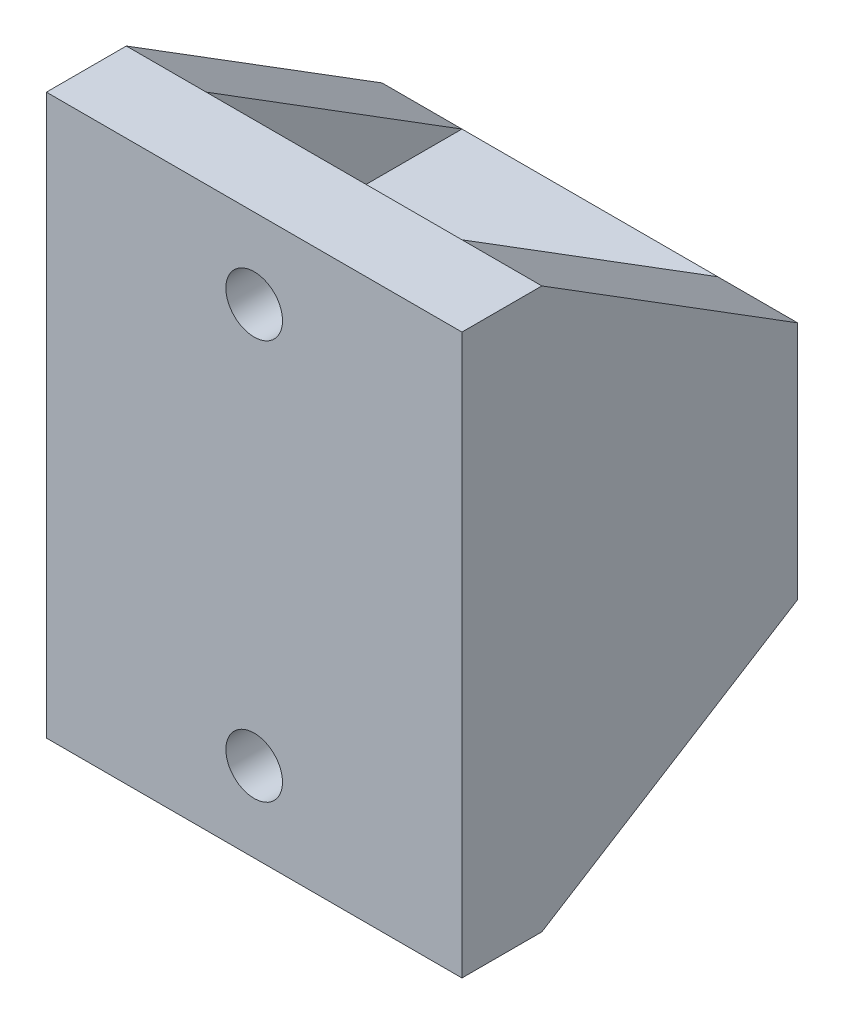
from build123d import *

# Parameters (mm, degrees)
ESQUISSE1_W             = 33.02
ESQUISSE1_H             = 19.05
BOSS_EXTRU_1_DEPTH      = 20.32
ESQUISSE2_R             = 2.4765
ENL_V_MAT_EXTRU_1_DEPTH = 33.378773911
ESQUISSE3_W             = 33.02
ESQUISSE3_H             = 44.45
BOSS_EXTRU_2_DEPTH      = 6.35
BOSS_EXTRU_3_DEPTH      = 6.35
ESQUISSE6_R             = 2.25
ENL_V_MAT_EXTRU_2_DEPTH = 35.342875899


with BuildPart() as part:
    # Esquisse1 → Boss.-Extru.1 (new body)
    with BuildSketch(Plane.XY):
        Rectangle(ESQUISSE1_W, ESQUISSE1_H)
        Polygon((-13.716, 4.3815), (-13.716, -4.3815), (13.716, -4.3815), (13.716, 4.3815), (10.16, 4.3815), (10.16, -0.5715), (-10.16, -0.5715), (-10.16, 4.3815), align=None, mode=Mode.SUBTRACT)
    extrude(amount=BOSS_EXTRU_1_DEPTH)

    # Esquisse2 → Enlèv. mat.-Extru.1 (cut, through all)
    with BuildSketch(Plane(origin=(0, 9.525, 0), x_dir=(1, 0, 0), z_dir=(0, 1, 0))):
        with Locations(Location((0, -10.287, 0), (0, 0, 270))):
            Circle(ESQUISSE2_R)
    extrude(amount=-ENL_V_MAT_EXTRU_1_DEPTH, mode=Mode.SUBTRACT)

    # Esquisse3 → Boss.-Extru.2 (add)
    with BuildSketch(Plane.XY.offset(20.32)):
        Rectangle(ESQUISSE3_W, ESQUISSE3_H)
    extrude(amount=BOSS_EXTRU_2_DEPTH)

    # Esquisse5 → Boss.-Extru.3 (add)
    with BuildSketch(Plane(origin=(16.51, 0, 0), x_dir=(0, 0, -1), z_dir=(1, 0, 0))):
        Polygon((-20.32, -22.225), (0, -9.525), (-20.32, -9.525), align=None)
        Polygon((-20.32, 22.225), (0, 9.525), (-20.32, 9.525), align=None)
    boss_extru_3 = extrude(amount=-BOSS_EXTRU_3_DEPTH)

    # Symétrie1: Boss.-Extru.3 across plane
    add(boss_extru_3.mirror(Plane(origin=(0, 0, 0), x_dir=(0, 0, 1), z_dir=(1, 0, 0))))

    # Esquisse6 → Enlèv. mat.-Extru.2 (cut, through all)
    with BuildSketch(Plane(origin=(0, 0, 20.32), x_dir=(-1, 0, 0), z_dir=(0, 0, -1))):
        with Locations((0, -15.875)):
            Circle(ESQUISSE6_R)
        with Locations(Location((0, 15.875, 0), (0, 0, 180))):
            Circle(ESQUISSE6_R)
    extrude(amount=-ENL_V_MAT_EXTRU_2_DEPTH, mode=Mode.SUBTRACT)


solid = part.part
